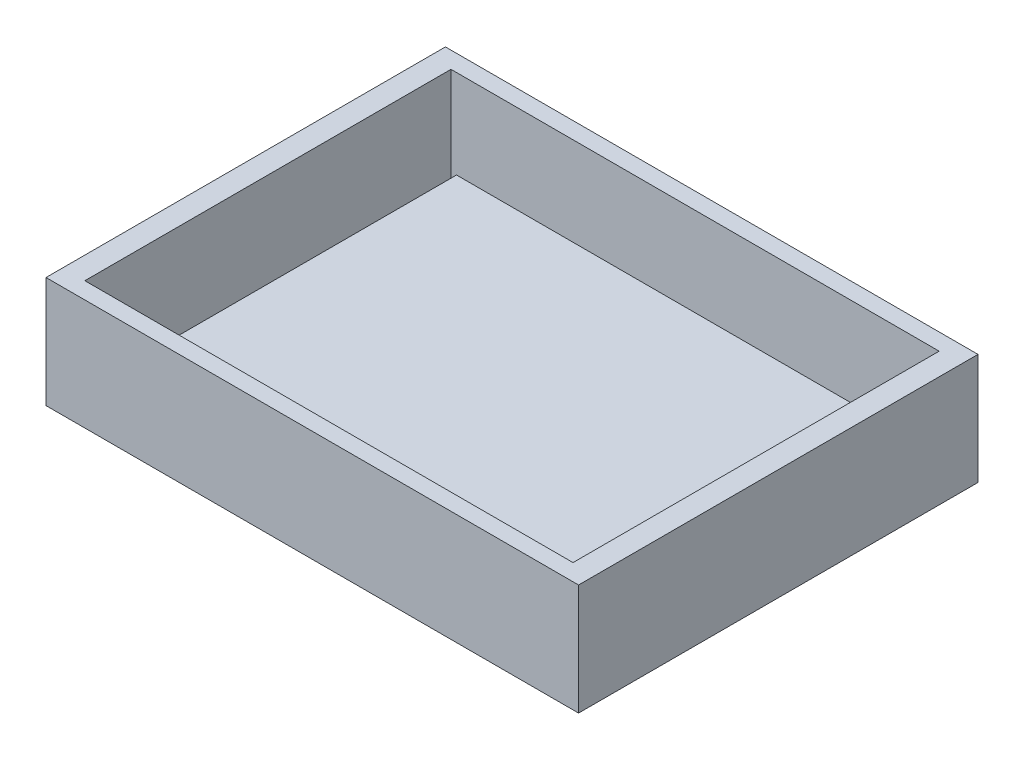
from build123d import *

# Parameters (mm, degrees)
SKETCH_1_W          = 80
SKETCH_1_H          = 60
EXTRUDE_1_DEPTH     = 5
SKETCH_2_W          = 96
SKETCH_2_H          = 72
EXTRUDE_2_DEPTH     = 20
SKETCH_3_W          = 88
SKETCH_3_H          = 66
CUT_EXTRUDE_1_DEPTH = 18
SKETCH_5_W          = 80
SKETCH_5_H          = 60
EXTRUDE_3_DEPTH     = 5


with BuildPart() as part:
    # 草图1 → 凸台-拉伸1 (new body)
    with BuildSketch(Plane(origin=(0, 0, 0), x_dir=(1, 0, 0), z_dir=(0, 1, 0))):
        with Locations((5.833333333, 4.444444444)):
            Rectangle(SKETCH_1_W, SKETCH_1_H)
    extrude(amount=EXTRUDE_1_DEPTH)

    # 草图2 → 凸台-拉伸2 (add)
    with BuildSketch(Plane.XZ):
        with Locations((5.833333333, -2.444444444)):
            Rectangle(SKETCH_2_W, SKETCH_2_H)
    extrude(amount=-EXTRUDE_2_DEPTH)

    # 草图3 → 切除-拉伸1 (cut)
    with BuildSketch(Plane(origin=(0, 20, 0), x_dir=(1, 0, 0), z_dir=(0, 1, 0))):
        with Locations((5.833333333, 2.444444444)):
            Rectangle(SKETCH_3_W, SKETCH_3_H)
    extrude(amount=-CUT_EXTRUDE_1_DEPTH, mode=Mode.SUBTRACT)

    # 草图5 → 凸台-拉伸3 (add)
    with BuildSketch(Plane(origin=(0, 2, 0), x_dir=(1, 0, 0), z_dir=(0, 1, 0))):
        with Locations((5.833333333, 2.444444444)):
            Rectangle(SKETCH_5_W, SKETCH_5_H)
    extrude(amount=EXTRUDE_3_DEPTH)


solid = part.part
